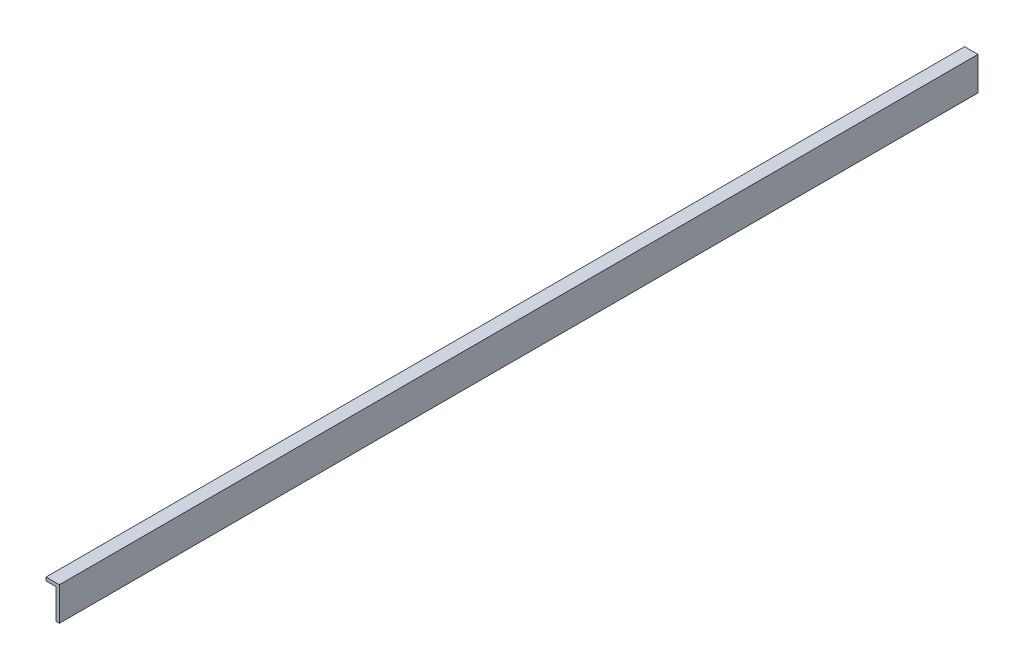
from build123d import *

# Parameters (mm, degrees)
OVEN_YAG_KABI_L_RAF_SAG_1_START = -30
OVEN_YAG_KABI_L_RAF_SAG_1_DEPTH = 550


with BuildPart() as part:
    # Sketch1 → OVEN_yag_kabi_L_raf_sag_1 (new body)
    with BuildSketch(Plane.XY.offset(OVEN_YAG_KABI_L_RAF_SAG_1_START)):
        Polygon((164, 870), (166, 870), (166, 890), (158, 890), (158, 888), (164, 888), align=None)
    extrude(amount=-OVEN_YAG_KABI_L_RAF_SAG_1_DEPTH)


solid = part.part
